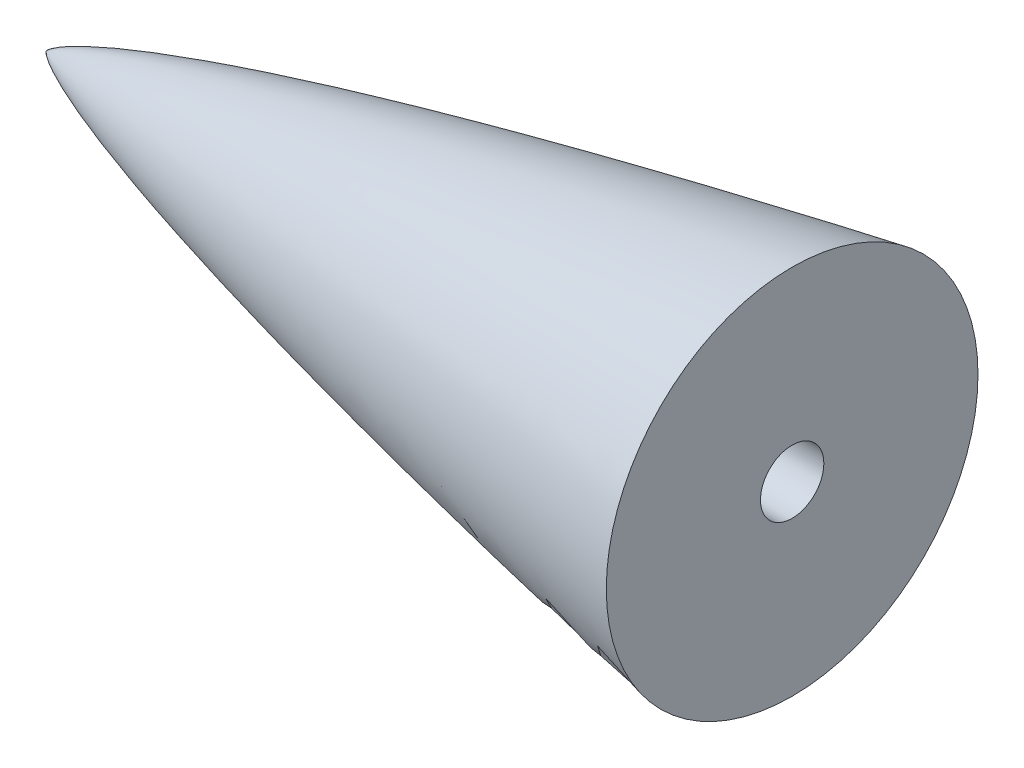
from build123d import *

# Parameters (mm, degrees)
SKETCH2_R          = 3.4
CUT_EXTRUDE1_DEPTH = 40


with BuildPart() as part:
    # Sketch1 → nosecone (revolve)
    with BuildSketch(Plane.XY):
        with BuildLine():
            Line((522, 64), (522, 0))
            Line((522, 0), (0, 0))
            add(Edge.make_bspline(
                [(0, 0), (0.001826953, 0.006816181), (0.006771486, 0.019936491), (0.021506417, 0.044166263), (0.046661717, 0.077995323), (0.079258284, 0.115021795), (0.126589165, 0.1631126), (0.184725886, 0.216219225), (0.25368033, 0.273933256), (0.3336007, 0.335900322), (0.460446691, 0.428551795), (0.660423817, 0.56263485), (0.982994634, 0.758855246), (1.534590027, 1.060170132), (2.465111939, 1.514644597), (4.12322816, 2.230092141), (7.193139768, 3.388122977), (12.880029643, 5.240285309), (22.608227584, 7.961769734), (39.482108423, 12.034562333), (62.843954379, 16.872422149), (91.388928515, 22.077714797), (123.506939437, 27.314789053), (155.694792914, 32.098908935), (187.936268488, 36.506706047), (220.220524829, 40.587704184), (252.541063501, 44.370523086), (284.893049861, 47.873353173), (313.225812895, 50.70042069), (337.527208669, 52.954297833), (357.78867383, 54.717201133), (374.003843123, 56.056867076), (390.224875338, 57.323634808), (406.451649281, 58.514543694), (422.684094329, 59.625536005), (436.892399391, 60.523006492), (449.074445036, 61.234348916), (459.228488268, 61.785275673), (467.353134193, 62.199305564), (474.463438705, 62.536502787), (480.558876848, 62.806052202), (485.639004312, 63.016686188), (489.703465178, 63.176292335), (496.025715941, 63.409883926), (502.151121166, 63.609445791), (508.079596574, 63.773693753), (513.811063557, 63.896378115), (516.677010914, 63.946393952), (519.133691426, 63.980267001), (520.77156104, 63.994268893), (521.590516942, 64), (522, 64)],
                knots=[0, 0, 0, 0, 0, 5.3359e-05, 0.000106717, 0.000213435, 0.000320152, 0.000426869, 0.000618636, 0.000810403, 0.001002169, 0.001193936, 0.001810104, 0.002636369, 0.003865352, 0.005960687, 0.009663494, 0.016331671, 0.028747863, 0.051319548, 0.086278578, 0.147994086, 0.209709638, 0.271425063, 0.333140753, 0.394856375, 0.456571956, 0.518287567, 0.580003173, 0.641718727, 0.672576571, 0.703434416, 0.734292234, 0.765150051, 0.79600786, 0.826865668, 0.857723431, 0.873152313, 0.888581195, 0.904010107, 0.919439018, 0.927153474, 0.93486793, 0.942582386, 0.950296842, 0.975148421, 0.981361316, 0.98757421, 0.993787105, 0.996893553, 1, 1, 1, 1, 1], degree=4))
        make_face()
    revolve(axis=Axis((-5.186257975, 0, 0), (1, 0, 0)))

    # SurfaceCut1
    split(bisect_by=Plane(origin=(80, 0, 0), x_dir=(0, 0, -1), z_dir=(1, 0, 0)), keep=Keep.BOTTOM)

    # Sketch2 → Cut-Extrude1 (cut)
    with BuildSketch(Plane(origin=(80, 0, 0), x_dir=(0, 0, -1), z_dir=(1, 0, 0))):
        Circle(SKETCH2_R)
    extrude(amount=-CUT_EXTRUDE1_DEPTH, mode=Mode.SUBTRACT)


solid = part.part
